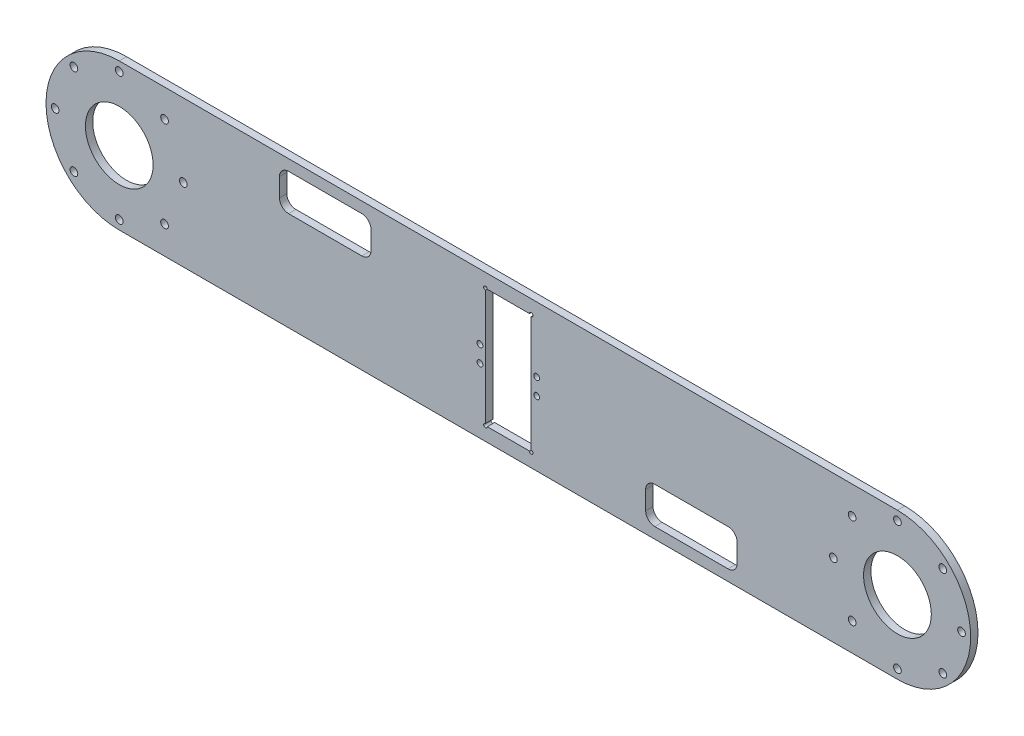
from build123d import *

# Parameters (mm, degrees)
EXTRUDE_1_DEPTH     = 4
SKETCH_3_R          = 18.5
CUT_EXTRUDE_2_DEPTH = 256.679975751
SKETCH_6_R          = 2.1
CUT_EXTRUDE_5_DEPTH = 256.679975751
SKETCH_7_W          = 25
SKETCH_7_H          = 65
CUT_EXTRUDE_6_DEPTH = 256.679975751
SKETCH_8_R          = 1
CUT_EXTRUDE_7_DEPTH = 256.679975751
SKETCH_9_R          = 1.6
CUT_EXTRUDE_8_DEPTH = 256.679975751
SKETCH_10_W         = 50
SKETCH_10_H         = 20
CUT_EXTRUDE_9_DEPTH = 256.679975751
FILLET_2_R          = 5


with BuildPart() as part:
    # 草图1 → 凸台-拉伸1 (new body)
    with BuildSketch(Plane.XY):
        with BuildLine():
            Line((-212.5, 40), (212.5, 40))
            ThreePointArc((212.5, 40), (252.5, 0), (212.5, -40))
            Line((212.5, -40), (-212.5, -40))
            ThreePointArc((-212.5, -40), (-252.5, 0), (-212.5, 40))
        make_face()
    extrude(amount=EXTRUDE_1_DEPTH)

    # 草图3 → 切除-拉伸2 (cut, through all)
    with BuildSketch(Plane.XY.offset(4)):
        with Locations((-212.5, 0)):
            Circle(SKETCH_3_R)
        with Locations((212.5, 0)):
            Circle(SKETCH_3_R)
    extrude(amount=-CUT_EXTRUDE_2_DEPTH, mode=Mode.SUBTRACT)

    # 草图6 → 切除-拉伸5 (cut, through all)
    with BuildSketch(Plane(origin=(0, 0, 0), x_dir=(-1, 0, 0), z_dir=(0, 0, -1))):
        with Locations((-247.5, 0)):
            Circle(SKETCH_6_R)
        with Locations((-237.248737342, 24.748737342)):
            Circle(SKETCH_6_R)
        with Locations((-212.5, 35)):
            Circle(SKETCH_6_R)
        with Locations((-187.751262658, 24.748737342)):
            Circle(SKETCH_6_R)
        with Locations((-177.5, 0)):
            Circle(SKETCH_6_R)
        with Locations((-187.751262658, -24.748737342)):
            Circle(SKETCH_6_R)
        with Locations((-212.5, -35)):
            Circle(SKETCH_6_R)
        with Locations((-237.248737342, -24.748737342)):
            Circle(SKETCH_6_R)
    cut_extrude_5 = extrude(amount=-CUT_EXTRUDE_5_DEPTH, mode=Mode.SUBTRACT)

    # 镜向1: 切除-拉伸5 across plane
    add(cut_extrude_5.mirror(Plane(origin=(0, 0, 0), x_dir=(0, 0, 1), z_dir=(1, 0, 0))), mode=Mode.SUBTRACT)

    # 草图7 → 切除-拉伸6 (cut, through all)
    with BuildSketch(Plane(origin=(0, 0, 0), x_dir=(-1, 0, 0), z_dir=(0, 0, -1))):
        Rectangle(SKETCH_7_W, SKETCH_7_H)
    extrude(amount=-CUT_EXTRUDE_6_DEPTH, mode=Mode.SUBTRACT)

    # 草图8 → 切除-拉伸7 (cut, through all)
    with BuildSketch(Plane(origin=(0, 0, 0), x_dir=(-1, 0, 0), z_dir=(0, 0, -1))):
        with Locations((-12.5, 32.5)):
            Circle(SKETCH_8_R)
        with Locations((12.5, 32.5)):
            Circle(SKETCH_8_R)
        with Locations((-12.5, -32.5)):
            Circle(SKETCH_8_R)
        with Locations((12.5, -32.5)):
            Circle(SKETCH_8_R)
    extrude(amount=-CUT_EXTRUDE_7_DEPTH, mode=Mode.SUBTRACT)

    # 草图9 → 切除-拉伸8 (cut, through all)
    with BuildSketch(Plane(origin=(0, 0, 0), x_dir=(-1, 0, 0), z_dir=(0, 0, -1))):
        with Locations((-15.5, -4.5)):
            Circle(SKETCH_9_R)
        with Locations(Location((-15.5, 4.5, 0), (0, 0, 180))):
            Circle(SKETCH_9_R)
        with Locations(Location((15.5, -4.5, 0), (0, 0, 180))):
            Circle(SKETCH_9_R)
        with Locations((15.5, 4.5)):
            Circle(SKETCH_9_R)
    extrude(amount=-CUT_EXTRUDE_8_DEPTH, mode=Mode.SUBTRACT)

    # 草图10 → 切除-拉伸9 (cut, through all)
    with BuildSketch(Plane.XY.offset(4)):
        with Locations((100, -24)):
            Rectangle(SKETCH_10_W, SKETCH_10_H)
        with Locations((-100, 24)):
            Rectangle(SKETCH_10_W, SKETCH_10_H)
    extrude(amount=-CUT_EXTRUDE_9_DEPTH, mode=Mode.SUBTRACT)

    # 圆角2
    fillet_2_edges = [part.edges().sort_by_distance(p)[0] for p in [
        (75, -34, 2),
        (75, -14, 2),
        (125, -14, 2),
        (125, -34, 2),
        (-125, 34, 2),
        (-75, 34, 2),
        (-75, 14, 2),
        (-125, 14, 2),
    ]]
    fillet(fillet_2_edges, radius=FILLET_2_R)


solid = part.part
